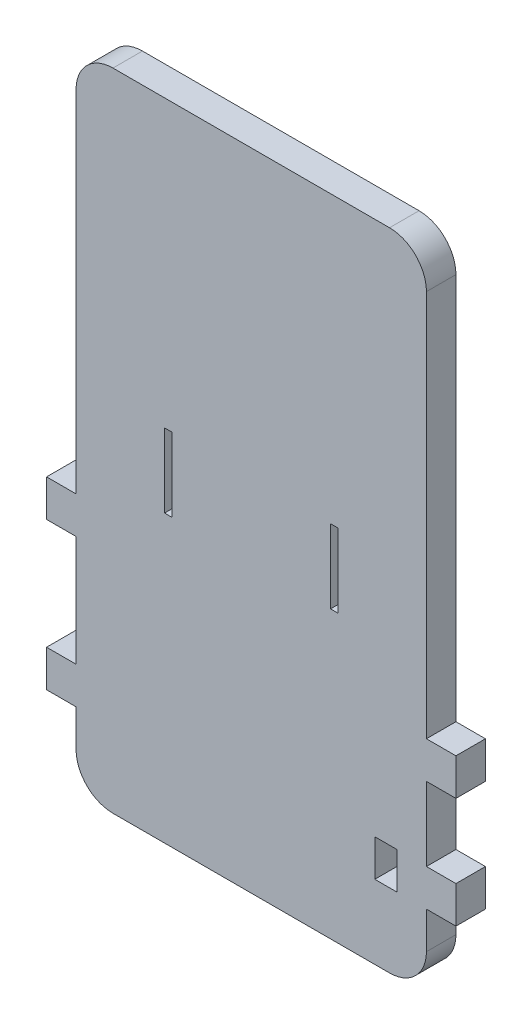
from build123d import *

# Parameters (mm, degrees)
SKETCH1_W           = 2
SKETCH1_H           = 20
SKETCH1_W_2         = 6
SKETCH1_H_2         = 10
BOSS_EXTRUDE1_DEPTH = 8
SKETCH3_W           = 8
SKETCH3_H           = 10
BOSS_EXTRUDE2_DEPTH = 8
SKETCH4_W           = 8
SKETCH4_H           = 10
BOSS_EXTRUDE3_DEPTH = 8


with BuildPart() as part:
    # Sketch1 → Boss-Extrude1 (new body)
    with BuildSketch(Plane.XY):
        with BuildLine():
            Line((-37.5, -87.5), (37.5, -87.5))
            ThreePointArc((37.5, -87.5), (44.571067812, -84.571067812), (47.5, -77.5))
            Line((47.5, -77.5), (47.5, 77.5))
            ThreePointArc((47.5, 77.5), (44.571067812, 84.571067812), (37.5, 87.5))
            Line((37.5, 87.5), (-37.5, 87.5))
            ThreePointArc((-37.5, 87.5), (-44.571067812, 84.571067812), (-47.5, 77.5))
            Line((-47.5, 77.5), (-47.5, -77.5))
            ThreePointArc((-47.5, -77.5), (-44.571067812, -84.571067812), (-37.5, -87.5))
        make_face()
        with Locations((-22.5, 0)):
            Rectangle(SKETCH1_W, SKETCH1_H, mode=Mode.SUBTRACT)
        with Locations((22.5, 0)):
            Rectangle(SKETCH1_W, SKETCH1_H, mode=Mode.SUBTRACT)
        with Locations((36.5, -62.5)):
            Rectangle(SKETCH1_W_2, SKETCH1_H_2, mode=Mode.SUBTRACT)
    extrude(amount=BOSS_EXTRUDE1_DEPTH)

    # Sketch3 → Boss-Extrude2 (add)
    with BuildSketch(Plane.ZY.offset(47.5)):
        with Locations((4, -62.5)):
            Rectangle(SKETCH3_W, SKETCH3_H)
        with Locations((4, -22.5)):
            Rectangle(SKETCH3_W, SKETCH3_H)
    extrude(amount=BOSS_EXTRUDE2_DEPTH)

    # Sketch4 → Boss-Extrude3 (add)
    with BuildSketch(Plane(origin=(47.5, 0, 0), x_dir=(0, 0, -1), z_dir=(1, 0, 0))):
        with Locations((-4, -62.5)):
            Rectangle(SKETCH4_W, SKETCH4_H)
        with Locations((-4, -32.5)):
            Rectangle(SKETCH4_W, SKETCH4_H)
    extrude(amount=BOSS_EXTRUDE3_DEPTH)


solid = part.part
